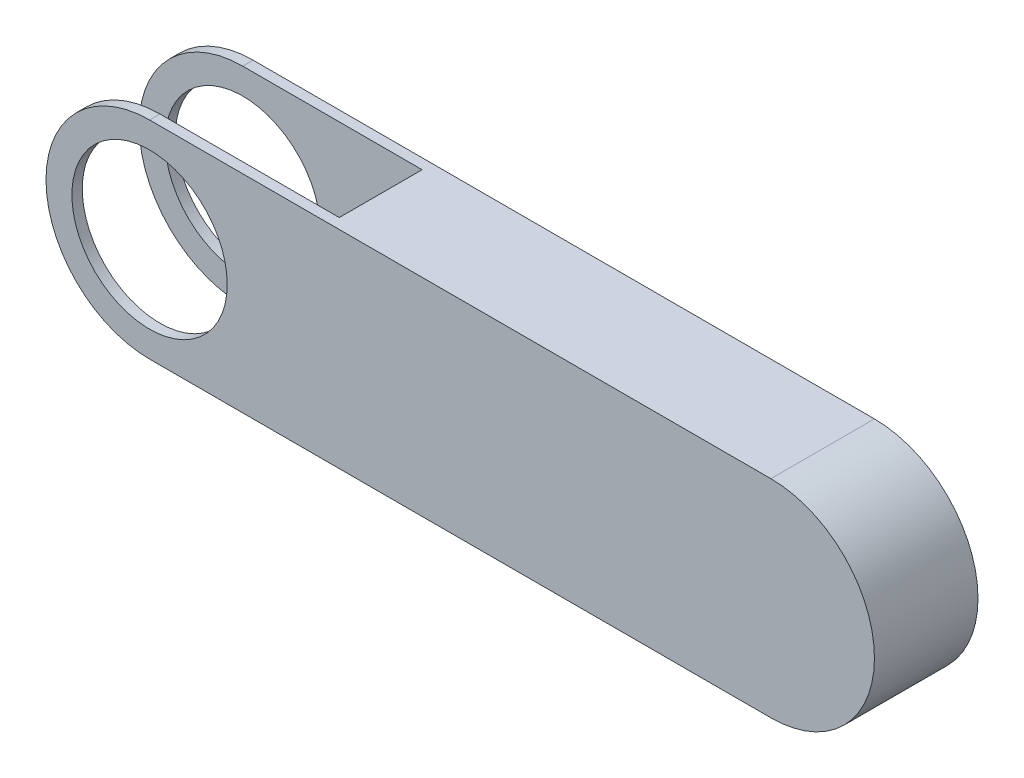
from build123d import *

# Parameters (mm, degrees)
BOSS_EXTRUDE1_DEPTH      = 50
BOSS_EXTRUDE1_DEPTH_BACK = 50
CUT_EXTRUDE1_DEPTH       = 50
CUT_EXTRUDE1_DEPTH_BACK  = 50
SKETCH3_R                = 75
CUT_EXTRUDE2_DEPTH       = 40
CUT_EXTRUDE2_DEPTH_BACK  = 40
SKETCH4_R                = 200


with BuildPart() as part:
    # Sketch2 → Boss-Extrude1 (new, two sides: drawn at the far end of the back side and taken through both)
    with BuildSketch(Plane.XY.offset(-BOSS_EXTRUDE1_DEPTH_BACK)):
        with BuildLine():
            Line((600, 100), (0, 100))
            ThreePointArc((0, 100), (-100, 0), (0, -100))
            Line((0, -100), (600, -100))
            ThreePointArc((600, -100), (700, 0), (600, 100))
        make_face()
    extrude(amount=BOSS_EXTRUDE1_DEPTH + BOSS_EXTRUDE1_DEPTH_BACK)

    # Sketch3 → Cut-Extrude1 (cut, two sides: drawn at the far end of the back side and taken through both)
    with BuildSketch(Plane.XY.offset(-CUT_EXTRUDE1_DEPTH_BACK)):
        Circle(SKETCH3_R)
    extrude(amount=CUT_EXTRUDE1_DEPTH + CUT_EXTRUDE1_DEPTH_BACK, mode=Mode.SUBTRACT)

    # Sketch4 → Cut-Extrude2 (cut, two sides: drawn at the far end of the back side and taken through both)
    with BuildSketch(Plane.XY.offset(-CUT_EXTRUDE2_DEPTH_BACK)):
        Circle(SKETCH4_R)
    extrude(amount=CUT_EXTRUDE2_DEPTH + CUT_EXTRUDE2_DEPTH_BACK, mode=Mode.SUBTRACT)


solid = part.part
